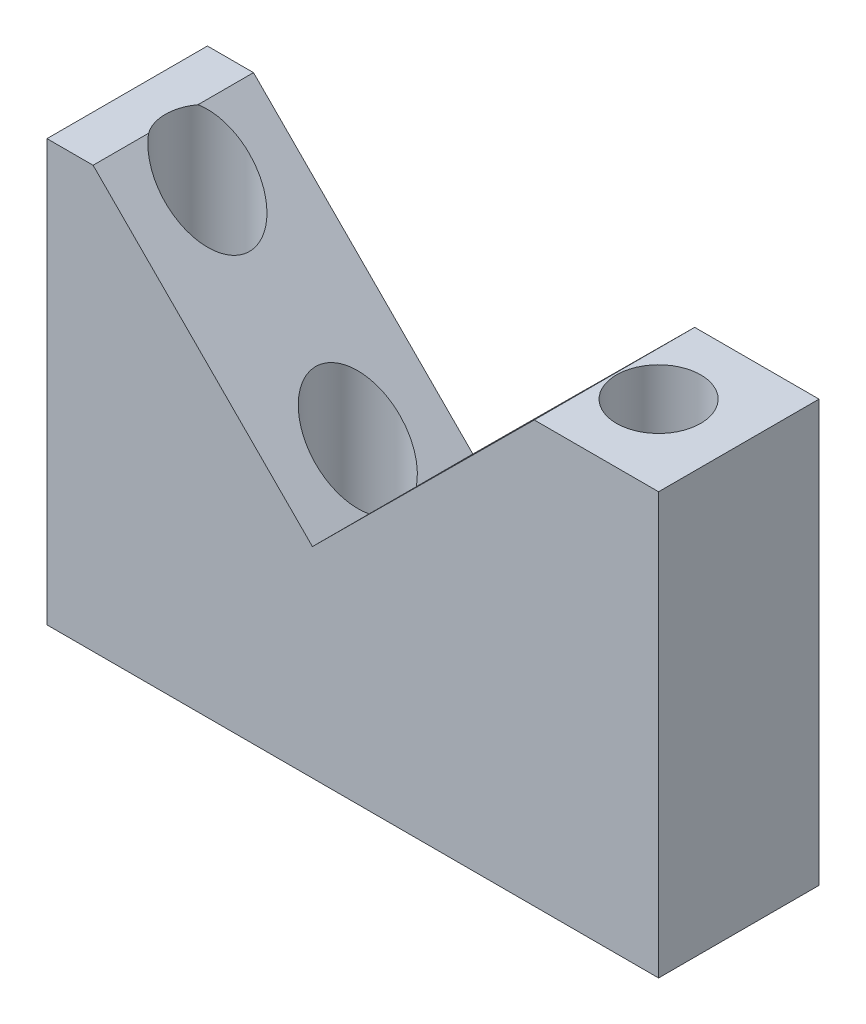
from build123d import *

# Parameters (mm, degrees)
SKETCH1_W           = 30.5
SKETCH1_H           = 8
SKETCH1_R           = 2.1
BOSS_EXTRUDE1_DEPTH = 21
CUT_EXTRUDE1_DEPTH  = 17.5
SKETCH4_R           = 2.1
CUT_EXTRUDE3_DEPTH  = 38.5
SKETCH6_R           = 2.1
BOSS_EXTRUDE3_DEPTH = 2
SKETCH7_R           = 2.1
BOSS_EXTRUDE4_DEPTH = 3


with BuildPart() as part:
    # Sketch1 → Boss-Extrude1 (new body)
    with BuildSketch(Plane(origin=(0, 0, 0), x_dir=(1, 0, 0), z_dir=(0, 1, 0))):
        with Locations((3.75, 0)):
            Rectangle(SKETCH1_W, SKETCH1_H)
        with Locations(Location((0, 0, 0), (0, 0, 90))):
            Circle(SKETCH1_R, mode=Mode.SUBTRACT)
        with Locations(Location((-7.5, 0, 0), (0, 0, 90))):
            Circle(SKETCH1_R, mode=Mode.SUBTRACT)
        with Locations(Location((7.5, 0, 0), (0, 0, 90))):
            Circle(SKETCH1_R, mode=Mode.SUBTRACT)
        with Locations(Location((15, 0, 0), (0, 0, 90))):
            Circle(SKETCH1_R, mode=Mode.SUBTRACT)
    extrude(amount=BOSS_EXTRUDE1_DEPTH)

    # Sketch2 → Cut-Extrude1 (cut)
    with BuildSketch(Plane.XY.offset(4)):
        Polygon((12.8, 21), (1.738392209, 10), (-9.200343126, 21), align=None)
    extrude(amount=-CUT_EXTRUDE1_DEPTH, mode=Mode.SUBTRACT)

    # Sketch4 → Cut-Extrude3 (cut)
    with BuildSketch(Plane(origin=(19, 0, 0), x_dir=(0, 0, -1), z_dir=(1, 0, 0))):
        with Locations((0, 4)):
            Circle(SKETCH4_R)
    extrude(amount=-CUT_EXTRUDE3_DEPTH, mode=Mode.SUBTRACT)

    # Sketch6 → Boss-Extrude3 (add)
    with BuildSketch(Plane.XZ):
        with Locations(Location((-7.5, 0, 0), (0, 0, 270))):
            Circle(SKETCH6_R)
        with Locations(Location((0, 0, 0), (0, 0, 270))):
            Circle(SKETCH6_R)
        with Locations(Location((7.5, 0, 0), (0, 0, 270))):
            Circle(SKETCH6_R)
        with Locations(Location((15, 0, 0), (0, 0, 90))):
            Circle(SKETCH6_R)
    extrude(amount=-BOSS_EXTRUDE3_DEPTH)

    # Sketch7 → Boss-Extrude4 (add)
    with BuildSketch(Plane(origin=(19, 0, 0), x_dir=(0, 0, -1), z_dir=(1, 0, 0))):
        with Locations((0, 4)):
            Circle(SKETCH7_R)
    extrude(amount=-BOSS_EXTRUDE4_DEPTH)


solid = part.part
